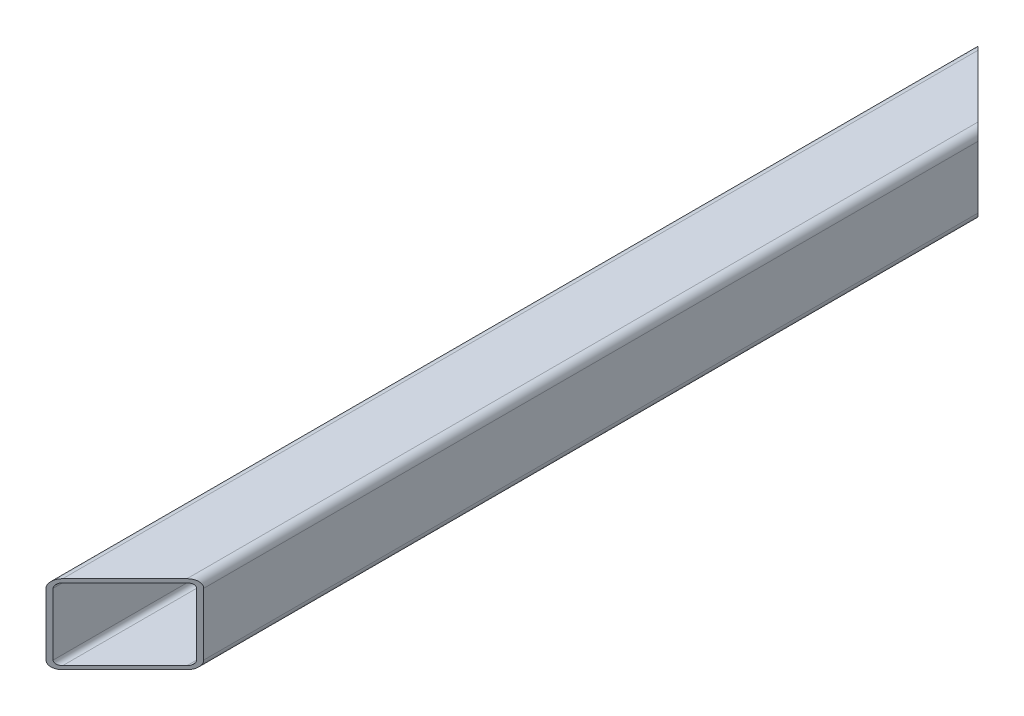
from build123d import *

# Parameters (mm, degrees)
EXTRUDE_1_DEPTH     = 390
CUT_EXTRUDE_1_DEPTH = 393.659203381


with BuildPart() as part:
    # Эскиз1 → Вытянуть-Тонкостенный1 (new body)
    with BuildSketch(Plane.XY):
        with BuildLine():
            Line((2, -1.5), (28, -1.5))
            ThreePointArc((28, -1.5), (30.474873734, -0.474873734), (31.5, 2))
            Line((31.5, 2), (31.5, 28))
            ThreePointArc((31.5, 28), (30.474873734, 30.474873734), (28, 31.5))
            Line((28, 31.5), (2, 31.5))
            ThreePointArc((2, 31.5), (-0.474873734, 30.474873734), (-1.5, 28))
            Line((-1.5, 28), (-1.5, 2))
            ThreePointArc((-1.5, 2), (-0.474873734, -0.474873734), (2, -1.5))
        make_face()
        with BuildLine():
            Line((2, 0), (28, 0))
            ThreePointArc((28, 0), (29.414213562, 0.585786438), (30, 2))
            Line((30, 2), (30, 28))
            ThreePointArc((30, 28), (29.414213562, 29.414213562), (28, 30))
            Line((28, 30), (2, 30))
            ThreePointArc((2, 30), (0.585786438, 29.414213562), (0, 28))
            Line((0, 28), (0, 2))
            ThreePointArc((0, 2), (0.585786438, 0.585786438), (2, 0))
        make_face(mode=Mode.SUBTRACT)
    extrude(amount=EXTRUDE_1_DEPTH)

    # Эскиз2 → Вырез-Вытянуть1 (cut, through all)
    with BuildSketch(Plane(origin=(0, 31.5, 0), x_dir=(1, 0, 0), z_dir=(0, 1, 0))):
        Polygon((-1.5, 0), (31.5, -33), (31.5, 0), align=None)
        Polygon((-1.5, -390), (31.5, -357), (31.5, -390), align=None)
    extrude(amount=-CUT_EXTRUDE_1_DEPTH, mode=Mode.SUBTRACT)


solid = part.part
